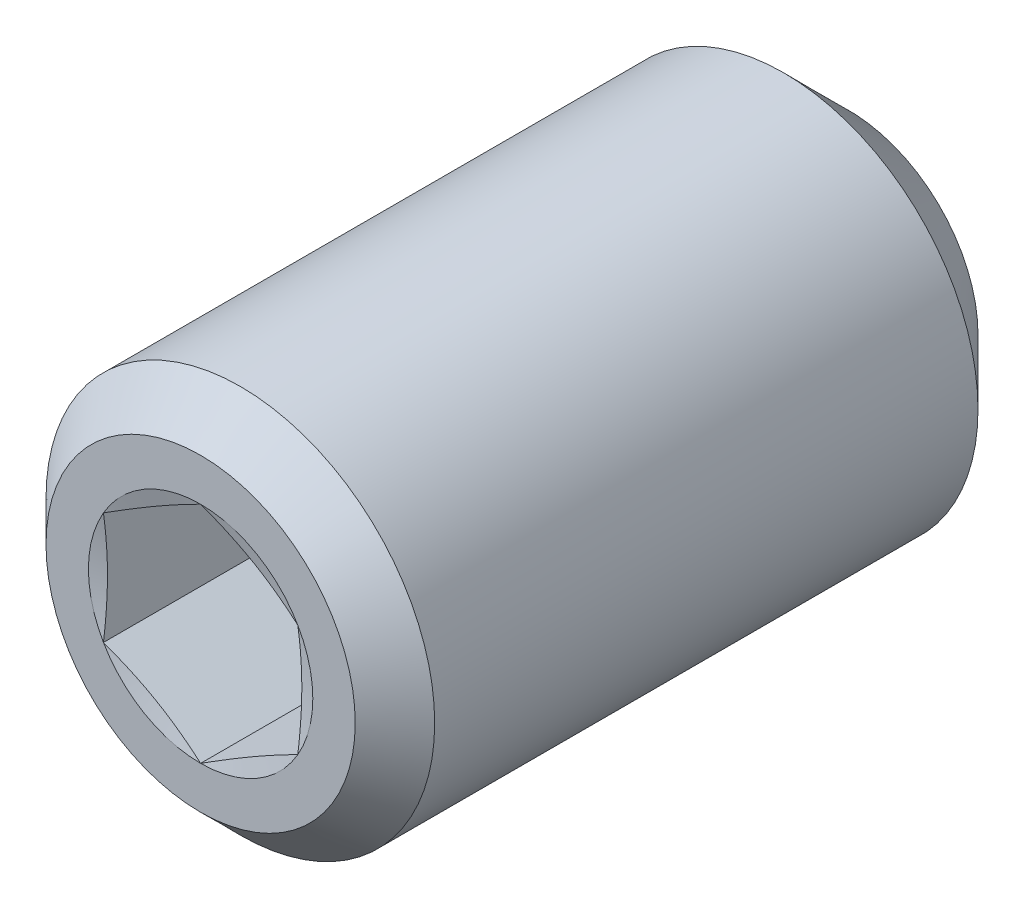
from build123d import *

# Parameters (mm, degrees)
CUT_EXTRUDE1_DEPTH = 1.2


with BuildPart() as part:
    # Sketch1 → Revolve1 (revolve)
    with BuildSketch(Plane(origin=(0, 0, 0), x_dir=(0, 0, -1), z_dir=(1, 0, 0)), mode=Mode.PRIVATE) as revolve1_sk:
        Polygon((0.3067, 1.5), (4.5, 1.5), (5, 1), (5, 0), (1.633012702, 0), (1.2, 0.75), (0, 0.75), (0, 1.1933), align=None)
    revolve(revolve1_sk.sketch.rotate(Axis((0, 0, 0), (0, 0, -1)), 90), axis=Axis((0, 0, 0), (0, 0, -1)))

    # Sketch2 → Cut-Extrude1 (cut)
    with BuildSketch(Plane.XY):
        Polygon((0, 0.866025404), (-0.75, 0.433012702), (-0.75, -0.433012702), (0, -0.866025404), (0.75, -0.433012702), (0.75, 0.433012702), align=None)
    extrude(amount=-CUT_EXTRUDE1_DEPTH, mode=Mode.SUBTRACT)

    # Sketch3 → Cut-Revolve2 (revolve, cut)
    with BuildSketch(Plane(origin=(0, 0, 0), x_dir=(0, 0, -1), z_dir=(1, 0, 0))):
        Polygon((0, 0.75), (0, 0.866025404), (0.031088913, 0.75), align=None)
    revolve(axis=Axis((0, 0, 0), (0, 0, -1)), mode=Mode.SUBTRACT)


solid = part.part
